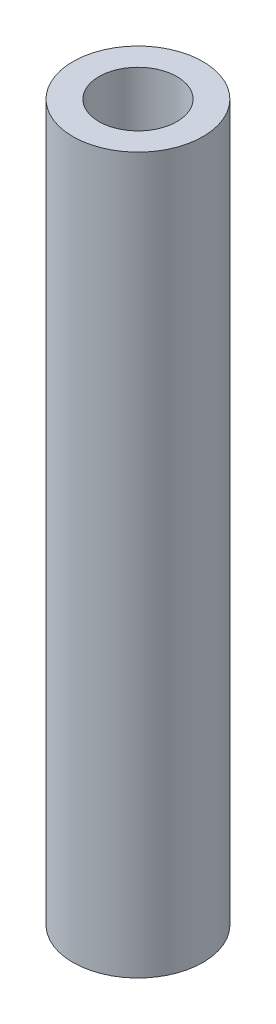
from build123d import *

# Parameters (mm, degrees)
SKETCH1_R           = 5
SKETCH1_R_2         = 3
BOSS_EXTRUDE1_DEPTH = 55


with BuildPart() as part:
    # Sketch1 → Boss-Extrude1 (new body)
    with BuildSketch(Plane(origin=(0, 0, 0), x_dir=(1, 0, 0), z_dir=(0, 1, 0))):
        with Locations(Location((0, 0, 0), (0, 0, 270))):
            Circle(SKETCH1_R)
        with Locations(Location((0, 0, 0), (0, 0, 270))):
            Circle(SKETCH1_R_2, mode=Mode.SUBTRACT)
    extrude(amount=BOSS_EXTRUDE1_DEPTH)


solid = part.part
